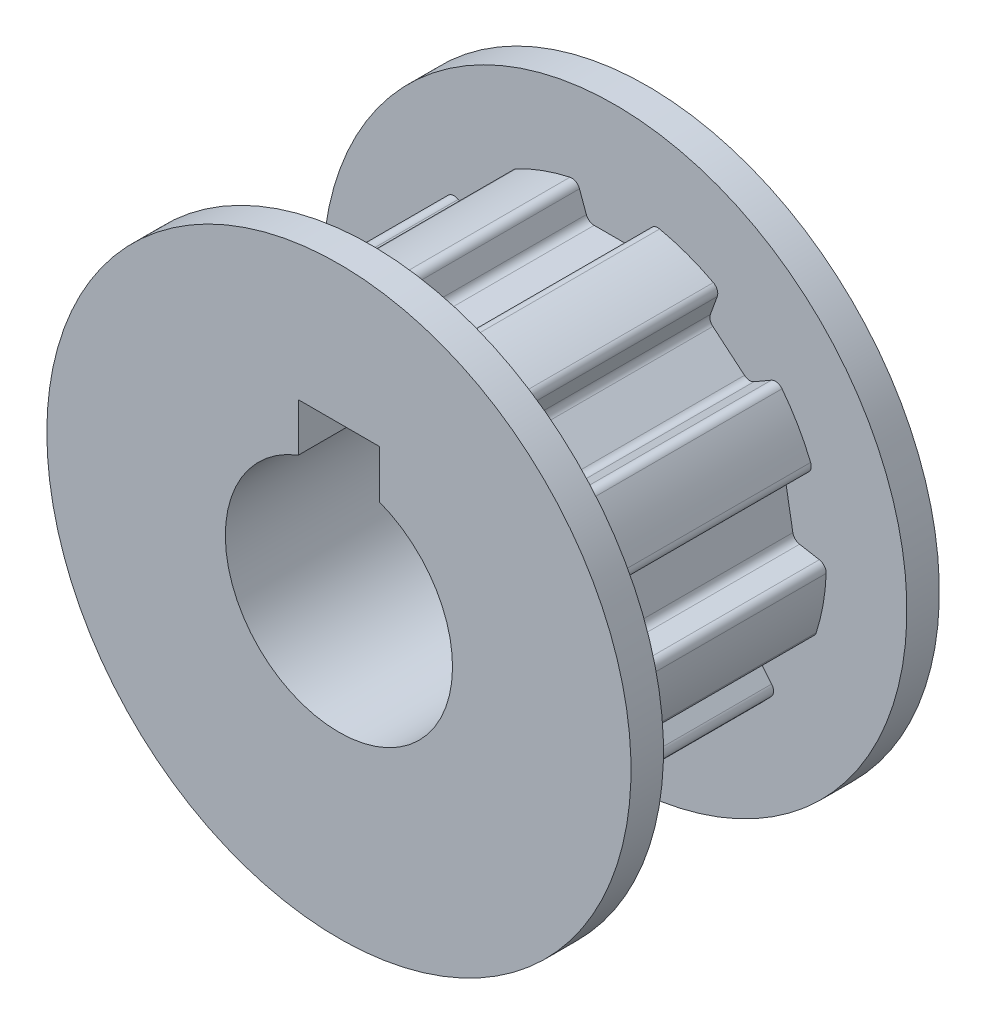
from build123d import *

# Parameters (mm, degrees)
CUT_EXTRUDE1_DEPTH              = 28.170756338
CUT_EXTRUDE1_DEPTH_BACK         = 28.170756338
SKETCH3_W                       = 5
SKETCH3_H                       = 9.5
BOSS_EXTRUDE1_REACH             = 29.171
SKETCH4_R                       = 13.03675669
SKETCH4_R_2                     = 11
BOSS_EXTRUDE1_DIRECTION_2_REACH = 29.171
CUT_EXTRUDE2_REACH              = 29.171
CUT_EXTRUDE2_DIRECTION_2_REACH  = 29.171
FILLET1_R                       = 0.51


with BuildPart() as part:
    # Sketch2 → Revolve1 (revolve)
    with BuildSketch(Plane(origin=(0, 0, 0), x_dir=(1, 0, 0), z_dir=(0, 1, 0)), mode=Mode.PRIVATE) as revolve1_sk:
        Polygon((7, -9.5), (7, 9.5), (18, 9.5), (18, 7.5), (11, 7.5), (11, -7.5), (18, -7.5), (18, -9.5), align=None)
    revolve(revolve1_sk.sketch.rotate(Axis((0, 0, -36.129595921), (0, 0, 1)), 180), axis=Axis((0, 0, -36.129595921), (0, 0, 1)))

    # Sketch3 → Cut-Extrude1 (cut, two sides: drawn at the far end of the back side and taken through both)
    with BuildSketch(Plane.XY.offset(-CUT_EXTRUDE1_DEPTH_BACK)):
        with Locations((0, 4.75)):
            Rectangle(SKETCH3_W, SKETCH3_H)
    extrude(amount=CUT_EXTRUDE1_DEPTH + CUT_EXTRUDE1_DEPTH_BACK, mode=Mode.SUBTRACT)

    # Sketch4 → Boss-Extrude1 (add, up to next)
    with BuildSketch(Plane.XY, mode=Mode.PRIVATE) as boss_extrude1_sk1:
        Circle(SKETCH4_R)
        Circle(SKETCH4_R_2, mode=Mode.SUBTRACT)
    boss_extrude1_tool1 = extrude(boss_extrude1_sk1.sketch, amount=BOSS_EXTRUDE1_REACH, mode=Mode.PRIVATE) - part.part
    add(boss_extrude1_tool1.solids().sort_by_distance((-12.668022, 0, 0))[0])

    # Sketch4 → Boss-Extrude1 direction 2 (add, up to next)
    with BuildSketch(Plane.XY, mode=Mode.PRIVATE) as boss_extrude1_direction_2_sk1:
        Circle(SKETCH4_R)
        Circle(SKETCH4_R_2, mode=Mode.SUBTRACT)
    boss_extrude1_direction_2_tool1 = extrude(boss_extrude1_direction_2_sk1.sketch, amount=-BOSS_EXTRUDE1_DIRECTION_2_REACH, mode=Mode.PRIVATE) - part.part
    add(boss_extrude1_direction_2_tool1.solids().sort_by_distance((-12.668022, 0, 0))[0])

    # Cut-Extrude2: up to this face of the body (flat: up to its plane)
    cut_extrude2_end = Plane(part.part.faces().sort_by_distance((17.490883118, 0, -7.5))[0])
    # Sketch5 → Cut-Extrude2 (cut, up to the picked face)
    with BuildSketch(Plane.XY, mode=Mode.PRIVATE) as cut_extrude2_sk1:
        Polygon((-1.629816853, 10.917758962), (1.629816853, 10.917758962), (2.401068952, 13.03675669), (-2.401068952, 13.03675669), align=None)
    cut_extrude2_tool1 = split(extrude(cut_extrude2_sk1.sketch, amount=-CUT_EXTRUDE2_REACH, mode=Mode.PRIVATE), bisect_by=cut_extrude2_end, keep=Keep.BOTH, mode=Mode.PRIVATE)
    # Sketch5 → Cut-Extrude2 (cut, up to the picked face)
    with BuildSketch(Plane.XY, mode=Mode.PRIVATE) as cut_extrude2_sk2:
        Polygon((5.769288043, 9.411114663), (8.26631233, 7.315862506), (10.219191199, 8.443357646), (6.540540143, 11.530112391), align=None)
    cut_extrude2_tool2 = split(extrude(cut_extrude2_sk2.sketch, amount=-CUT_EXTRUDE2_REACH, mode=Mode.PRIVATE), bisect_by=cut_extrude2_end, keep=Keep.BOTH, mode=Mode.PRIVATE)
    # Sketch5 → Cut-Extrude2 (cut, up to the picked face)
    with BuildSketch(Plane.XY, mode=Mode.PRIVATE) as cut_extrude2_sk3:
        Polygon((10.468878945, 3.50090522), (11.034908398, 0.290792676), (13.25564031, -0.100782277), (12.421757815, 4.628400361), align=None)
    cut_extrude2_tool3 = split(extrude(cut_extrude2_sk3.sketch, amount=-CUT_EXTRUDE2_REACH, mode=Mode.PRIVATE), bisect_by=cut_extrude2_end, keep=Keep.BOTH, mode=Mode.PRIVATE)
    # Sketch5 → Cut-Extrude2 (cut, up to the picked face)
    with BuildSketch(Plane.XY, mode=Mode.PRIVATE) as cut_extrude2_sk4:
        Polygon((10.26996504, -4.047416683), (8.640148187, -6.870342279), (10.089628001, -8.597765054), (12.490696953, -4.438991636), align=None)
    cut_extrude2_tool4 = split(extrude(cut_extrude2_sk4.sketch, amount=-CUT_EXTRUDE2_REACH, mode=Mode.PRIVATE), bisect_by=cut_extrude2_end, keep=Keep.BOTH, mode=Mode.PRIVATE)
    # Sketch5 → Cut-Extrude2 (cut, up to the picked face)
    with BuildSketch(Plane.XY, mode=Mode.PRIVATE) as cut_extrude2_sk5:
        Polygon((5.265620355, -9.701907339), (2.202566616, -10.816767726), (2.202566616, -13.071758008), (6.715100168, -11.429330114), align=None)
    cut_extrude2_tool5 = split(extrude(cut_extrude2_sk5.sketch, amount=-CUT_EXTRUDE2_REACH, mode=Mode.PRIVATE), bisect_by=cut_extrude2_end, keep=Keep.BOTH, mode=Mode.PRIVATE)
    # Sketch5 → Cut-Extrude2 (cut, up to the picked face)
    with BuildSketch(Plane.XY, mode=Mode.PRIVATE) as cut_extrude2_sk6:
        Polygon((-2.202566616, -10.816767726), (-5.265620355, -9.701907339), (-6.715100168, -11.429330114), (-2.202566616, -13.071758008), align=None)
    cut_extrude2_tool6 = split(extrude(cut_extrude2_sk6.sketch, amount=-CUT_EXTRUDE2_REACH, mode=Mode.PRIVATE), bisect_by=cut_extrude2_end, keep=Keep.BOTH, mode=Mode.PRIVATE)
    # Sketch5 → Cut-Extrude2 (cut, up to the picked face)
    with BuildSketch(Plane.XY, mode=Mode.PRIVATE) as cut_extrude2_sk7:
        Polygon((-8.640148187, -6.870342279), (-10.26996504, -4.047416683), (-12.490696953, -4.438991636), (-10.089628001, -8.597765054), align=None)
    cut_extrude2_tool7 = split(extrude(cut_extrude2_sk7.sketch, amount=-CUT_EXTRUDE2_REACH, mode=Mode.PRIVATE), bisect_by=cut_extrude2_end, keep=Keep.BOTH, mode=Mode.PRIVATE)
    # Sketch5 → Cut-Extrude2 (cut, up to the picked face)
    with BuildSketch(Plane.XY, mode=Mode.PRIVATE) as cut_extrude2_sk8:
        Polygon((-11.034908398, 0.290792676), (-10.468878945, 3.50090522), (-12.421757815, 4.628400361), (-13.25564031, -0.100782277), align=None)
    cut_extrude2_tool8 = split(extrude(cut_extrude2_sk8.sketch, amount=-CUT_EXTRUDE2_REACH, mode=Mode.PRIVATE), bisect_by=cut_extrude2_end, keep=Keep.BOTH, mode=Mode.PRIVATE)
    # Sketch5 → Cut-Extrude2 (cut, up to the picked face)
    with BuildSketch(Plane.XY, mode=Mode.PRIVATE) as cut_extrude2_sk9:
        Polygon((-8.26631233, 7.315862506), (-5.769288043, 9.411114663), (-6.540540143, 11.530112391), (-10.219191199, 8.443357646), align=None)
    cut_extrude2_tool9 = split(extrude(cut_extrude2_sk9.sketch, amount=-CUT_EXTRUDE2_REACH, mode=Mode.PRIVATE), bisect_by=cut_extrude2_end, keep=Keep.BOTH, mode=Mode.PRIVATE)
    add(cut_extrude2_tool1.solids().sort_by(Axis((0, 12.044831, 0), (0, 0, -1)))[0], mode=Mode.SUBTRACT)
    add(cut_extrude2_tool2.solids().sort_by(Axis((7.742268, 9.226876, 0), (0, 0, -1)))[0], mode=Mode.SUBTRACT)
    add(cut_extrude2_tool3.solids().sort_by(Axis((11.861843, 2.091563, 0), (0, 0, -1)))[0], mode=Mode.SUBTRACT)
    add(cut_extrude2_tool4.solids().sort_by(Axis((10.43113, -6.022416, 0), (0, 0, -1)))[0], mode=Mode.SUBTRACT)
    add(cut_extrude2_tool5.solids().sort_by(Axis((4.119575, -11.318439, 0), (0, 0, -1)))[0], mode=Mode.SUBTRACT)
    add(cut_extrude2_tool6.solids().sort_by(Axis((-4.119575, -11.318439, 0), (0, 0, -1)))[0], mode=Mode.SUBTRACT)
    add(cut_extrude2_tool7.solids().sort_by(Axis((-10.43113, -6.022416, 0), (0, 0, -1)))[0], mode=Mode.SUBTRACT)
    add(cut_extrude2_tool8.solids().sort_by(Axis((-11.861843, 2.091563, 0), (0, 0, -1)))[0], mode=Mode.SUBTRACT)
    add(cut_extrude2_tool9.solids().sort_by(Axis((-7.742268, 9.226876, 0), (0, 0, -1)))[0], mode=Mode.SUBTRACT)

    # Cut-Extrude2 direction 2: up to this face of the body (flat: up to its plane)
    cut_extrude2_direction_2_end = Plane(part.part.faces().sort_by_distance((17.490883118, 0, 7.5))[0])
    # Sketch5 → Cut-Extrude2 direction 2 (cut, up to the picked face)
    with BuildSketch(Plane.XY, mode=Mode.PRIVATE) as cut_extrude2_direction_2_sk1:
        Polygon((-1.629816853, 10.917758962), (1.629816853, 10.917758962), (2.401068952, 13.03675669), (-2.401068952, 13.03675669), align=None)
    cut_extrude2_direction_2_tool1 = split(extrude(cut_extrude2_direction_2_sk1.sketch, amount=CUT_EXTRUDE2_DIRECTION_2_REACH, mode=Mode.PRIVATE), bisect_by=cut_extrude2_direction_2_end, keep=Keep.BOTH, mode=Mode.PRIVATE)
    # Sketch5 → Cut-Extrude2 direction 2 (cut, up to the picked face)
    with BuildSketch(Plane.XY, mode=Mode.PRIVATE) as cut_extrude2_direction_2_sk2:
        Polygon((5.769288043, 9.411114663), (8.26631233, 7.315862506), (10.219191199, 8.443357646), (6.540540143, 11.530112391), align=None)
    cut_extrude2_direction_2_tool2 = split(extrude(cut_extrude2_direction_2_sk2.sketch, amount=CUT_EXTRUDE2_DIRECTION_2_REACH, mode=Mode.PRIVATE), bisect_by=cut_extrude2_direction_2_end, keep=Keep.BOTH, mode=Mode.PRIVATE)
    # Sketch5 → Cut-Extrude2 direction 2 (cut, up to the picked face)
    with BuildSketch(Plane.XY, mode=Mode.PRIVATE) as cut_extrude2_direction_2_sk3:
        Polygon((10.468878945, 3.50090522), (11.034908398, 0.290792676), (13.25564031, -0.100782277), (12.421757815, 4.628400361), align=None)
    cut_extrude2_direction_2_tool3 = split(extrude(cut_extrude2_direction_2_sk3.sketch, amount=CUT_EXTRUDE2_DIRECTION_2_REACH, mode=Mode.PRIVATE), bisect_by=cut_extrude2_direction_2_end, keep=Keep.BOTH, mode=Mode.PRIVATE)
    # Sketch5 → Cut-Extrude2 direction 2 (cut, up to the picked face)
    with BuildSketch(Plane.XY, mode=Mode.PRIVATE) as cut_extrude2_direction_2_sk4:
        Polygon((10.26996504, -4.047416683), (8.640148187, -6.870342279), (10.089628001, -8.597765054), (12.490696953, -4.438991636), align=None)
    cut_extrude2_direction_2_tool4 = split(extrude(cut_extrude2_direction_2_sk4.sketch, amount=CUT_EXTRUDE2_DIRECTION_2_REACH, mode=Mode.PRIVATE), bisect_by=cut_extrude2_direction_2_end, keep=Keep.BOTH, mode=Mode.PRIVATE)
    # Sketch5 → Cut-Extrude2 direction 2 (cut, up to the picked face)
    with BuildSketch(Plane.XY, mode=Mode.PRIVATE) as cut_extrude2_direction_2_sk5:
        Polygon((5.265620355, -9.701907339), (2.202566616, -10.816767726), (2.202566616, -13.071758008), (6.715100168, -11.429330114), align=None)
    cut_extrude2_direction_2_tool5 = split(extrude(cut_extrude2_direction_2_sk5.sketch, amount=CUT_EXTRUDE2_DIRECTION_2_REACH, mode=Mode.PRIVATE), bisect_by=cut_extrude2_direction_2_end, keep=Keep.BOTH, mode=Mode.PRIVATE)
    # Sketch5 → Cut-Extrude2 direction 2 (cut, up to the picked face)
    with BuildSketch(Plane.XY, mode=Mode.PRIVATE) as cut_extrude2_direction_2_sk6:
        Polygon((-2.202566616, -10.816767726), (-5.265620355, -9.701907339), (-6.715100168, -11.429330114), (-2.202566616, -13.071758008), align=None)
    cut_extrude2_direction_2_tool6 = split(extrude(cut_extrude2_direction_2_sk6.sketch, amount=CUT_EXTRUDE2_DIRECTION_2_REACH, mode=Mode.PRIVATE), bisect_by=cut_extrude2_direction_2_end, keep=Keep.BOTH, mode=Mode.PRIVATE)
    # Sketch5 → Cut-Extrude2 direction 2 (cut, up to the picked face)
    with BuildSketch(Plane.XY, mode=Mode.PRIVATE) as cut_extrude2_direction_2_sk7:
        Polygon((-8.640148187, -6.870342279), (-10.26996504, -4.047416683), (-12.490696953, -4.438991636), (-10.089628001, -8.597765054), align=None)
    cut_extrude2_direction_2_tool7 = split(extrude(cut_extrude2_direction_2_sk7.sketch, amount=CUT_EXTRUDE2_DIRECTION_2_REACH, mode=Mode.PRIVATE), bisect_by=cut_extrude2_direction_2_end, keep=Keep.BOTH, mode=Mode.PRIVATE)
    # Sketch5 → Cut-Extrude2 direction 2 (cut, up to the picked face)
    with BuildSketch(Plane.XY, mode=Mode.PRIVATE) as cut_extrude2_direction_2_sk8:
        Polygon((-11.034908398, 0.290792676), (-10.468878945, 3.50090522), (-12.421757815, 4.628400361), (-13.25564031, -0.100782277), align=None)
    cut_extrude2_direction_2_tool8 = split(extrude(cut_extrude2_direction_2_sk8.sketch, amount=CUT_EXTRUDE2_DIRECTION_2_REACH, mode=Mode.PRIVATE), bisect_by=cut_extrude2_direction_2_end, keep=Keep.BOTH, mode=Mode.PRIVATE)
    # Sketch5 → Cut-Extrude2 direction 2 (cut, up to the picked face)
    with BuildSketch(Plane.XY, mode=Mode.PRIVATE) as cut_extrude2_direction_2_sk9:
        Polygon((-8.26631233, 7.315862506), (-5.769288043, 9.411114663), (-6.540540143, 11.530112391), (-10.219191199, 8.443357646), align=None)
    cut_extrude2_direction_2_tool9 = split(extrude(cut_extrude2_direction_2_sk9.sketch, amount=CUT_EXTRUDE2_DIRECTION_2_REACH, mode=Mode.PRIVATE), bisect_by=cut_extrude2_direction_2_end, keep=Keep.BOTH, mode=Mode.PRIVATE)
    add(cut_extrude2_direction_2_tool1.solids().sort_by(Axis((0, 12.044831, 0), (0, 0, 1)))[0], mode=Mode.SUBTRACT)
    add(cut_extrude2_direction_2_tool2.solids().sort_by(Axis((7.742268, 9.226876, 0), (0, 0, 1)))[0], mode=Mode.SUBTRACT)
    add(cut_extrude2_direction_2_tool3.solids().sort_by(Axis((11.861843, 2.091563, 0), (0, 0, 1)))[0], mode=Mode.SUBTRACT)
    add(cut_extrude2_direction_2_tool4.solids().sort_by(Axis((10.43113, -6.022416, 0), (0, 0, 1)))[0], mode=Mode.SUBTRACT)
    add(cut_extrude2_direction_2_tool5.solids().sort_by(Axis((4.119575, -11.318439, 0), (0, 0, 1)))[0], mode=Mode.SUBTRACT)
    add(cut_extrude2_direction_2_tool6.solids().sort_by(Axis((-4.119575, -11.318439, 0), (0, 0, 1)))[0], mode=Mode.SUBTRACT)
    add(cut_extrude2_direction_2_tool7.solids().sort_by(Axis((-10.43113, -6.022416, 0), (0, 0, 1)))[0], mode=Mode.SUBTRACT)
    add(cut_extrude2_direction_2_tool8.solids().sort_by(Axis((-11.861843, 2.091563, 0), (0, 0, 1)))[0], mode=Mode.SUBTRACT)
    add(cut_extrude2_direction_2_tool9.solids().sort_by(Axis((-7.742268, 9.226876, 0), (0, 0, 1)))[0], mode=Mode.SUBTRACT)

    # Fillet1
    fillet1_edges = [part.edges().sort_by_distance(p)[0] for p in [
        (-5.769288043, 9.411114663, 0),
        (-8.26631233, 7.315862506, 0),
        (-10.468878945, 3.50090522, 0),
        (-11.034908398, 0.290792676, 0),
        (-10.26996504, -4.047416683, 0),
        (-8.640148187, -6.870342279, 0),
        (-5.265620355, -9.701907339, 0),
        (-2.202566616, -10.816767726, 0),
        (2.202566616, -10.816767726, 0),
        (5.265620355, -9.701907339, 0),
        (8.640148187, -6.870342279, 0),
        (10.26996504, -4.047416683, 0),
        (11.034908398, 0.290792676, 0),
        (10.468878945, 3.50090522, 0),
        (8.26631233, 7.315862506, 0),
        (5.769288043, 9.411114663, 0),
        (1.629816853, 10.917758962, 0),
        (-1.629816853, 10.917758962, 0),
        (-2.325, 12.827758962, 0),
        (2.325, 12.827758962, 0),
        (6.464471191, 11.321114663, 0),
        (10.026577851, 8.332152278, 0),
        (12.229144467, 4.517194993, 0),
        (13.036608493, -0.062161058, 0),
        (12.271665135, -4.400370417, 0),
        (9.946665135, -8.427388545, 0),
        (6.572137302, -11.258953605, 0),
        (2.202566616, -12.849347271, 0),
        (-2.202566616, -12.849347271, 0),
        (-6.572137302, -11.258953605, 0),
        (-9.946665135, -8.427388545, 0),
        (-12.271665135, -4.400370417, 0),
        (-13.036608493, -0.062161058, 0),
        (-12.229144467, 4.517194993, 0),
        (-10.026577851, 8.332152278, 0),
        (-6.464471191, 11.321114663, 0),
    ]]
    fillet(fillet1_edges, radius=FILLET1_R)


solid = part.part
